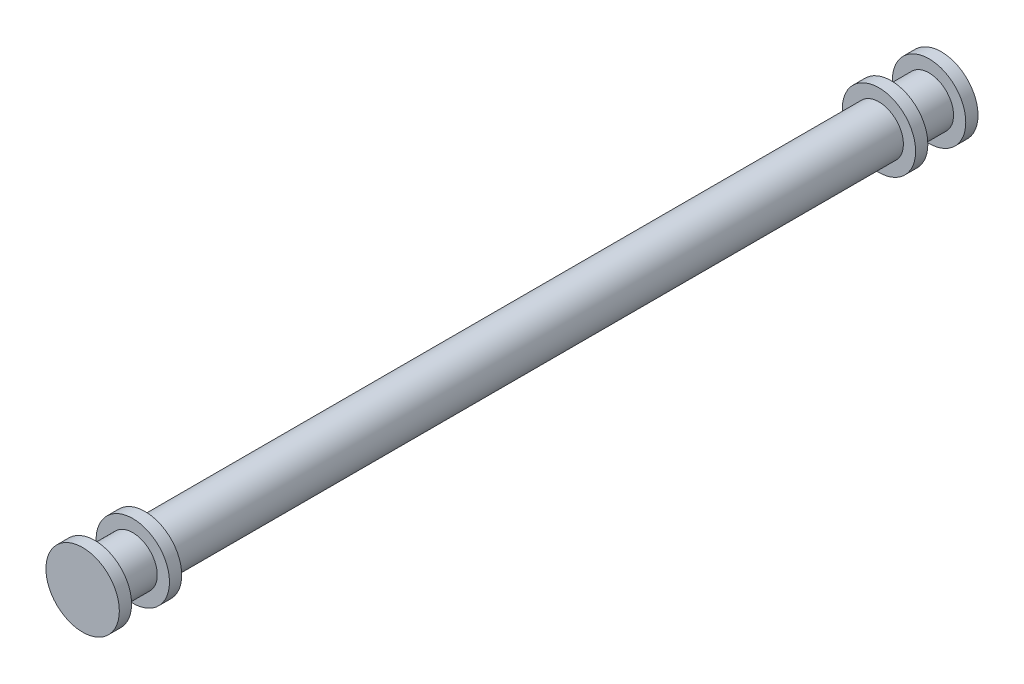
from build123d import *

# Parameters (mm, degrees)
SKETCH_1_R      = 4
EXTRUDE_1_DEPTH = 60
SKETCH_2_R      = 6
EXTRUDE_2_DEPTH = 2
EXTRUDE_START   = 6.2
SKETCH_3_R      = 4
EXTRUDE_3_DEPTH = 6.2
SKETCH_4_R      = 6
EXTRUDE_4_DEPTH = 2


with BuildPart() as part:
    # Эскиз1 → Бобышка-Вытянуть1 (new, symmetric)
    with BuildSketch(Plane.XY):
        Circle(SKETCH_1_R)
    extrude(amount=EXTRUDE_1_DEPTH, both=True)

    # Эскиз2 → Бобышка-Вытянуть2 (add)
    with BuildSketch(Plane.XY.offset(60)):
        Circle(SKETCH_2_R)
    extrude_2 = extrude(amount=EXTRUDE_2_DEPTH)

    # Эскиз3 → Бобышка-Вытянуть3 (add)
    with BuildSketch(Plane.XY.offset(62).offset(EXTRUDE_START)):
        Circle(SKETCH_3_R)
    extrude_3 = extrude(amount=-EXTRUDE_3_DEPTH)

    # Эскиз4 → Бобышка-Вытянуть4 (add)
    with BuildSketch(Plane.XY.offset(68.2)):
        Circle(SKETCH_4_R)
    extrude_4 = extrude(amount=EXTRUDE_4_DEPTH)

    # Зеркальное отражение1: Бобышка-Вытянуть2, Бобышка-Вытянуть3, Бобышка-Вытянуть4 across plane
    add(extrude_2.mirror(Plane.XY))
    add(extrude_3.mirror(Plane.XY))
    add(extrude_4.mirror(Plane.XY))


solid = part.part
